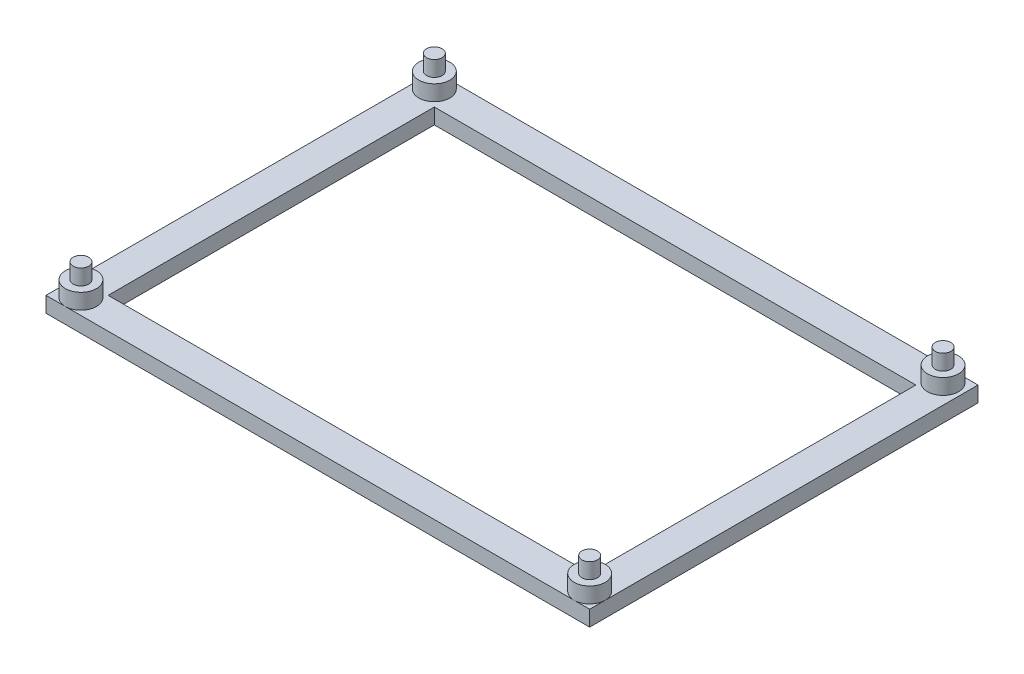
from build123d import *

# Parameters (mm, degrees)
SKETCH1_W           = 70
SKETCH1_H           = 50
BOSS_EXTRUDE1_DEPTH = 2
SKETCH2_R           = 1
BOSS_EXTRUDE2_DEPTH = 4
SKETCH3_R           = 2
BOSS_EXTRUDE3_DEPTH = 2
SKETCH4_W           = 62
SKETCH4_H           = 42
CUT_EXTRUDE1_DEPTH  = 2


with BuildPart() as part:
    # Sketch1 → Boss-Extrude1 (new body)
    with BuildSketch(Plane(origin=(0, 0, 0), x_dir=(1, 0, 0), z_dir=(0, 1, 0))):
        Rectangle(SKETCH1_W, SKETCH1_H)
    extrude(amount=BOSS_EXTRUDE1_DEPTH)

    # Sketch2 → Boss-Extrude2 (add)
    with BuildSketch(Plane(origin=(0, 2, 0), x_dir=(1, 0, 0), z_dir=(0, 1, 0))):
        with Locations(Location((-32.5, -23, 0), (0, 0, 90))):
            Circle(SKETCH2_R)
        with Locations(Location((-33, 23, 0), (0, 0, 90))):
            Circle(SKETCH2_R)
        with Locations(Location((32.5, 23, 0), (0, 0, 90))):
            Circle(SKETCH2_R)
        with Locations(Location((33, -23, 0), (0, 0, 90))):
            Circle(SKETCH2_R)
    extrude(amount=BOSS_EXTRUDE2_DEPTH)

    # Sketch3 → Boss-Extrude3 (add)
    with BuildSketch(Plane(origin=(0, 2, 0), x_dir=(1, 0, 0), z_dir=(0, 1, 0))):
        with Locations(Location((-33, 23, 0), (0, 0, 90))):
            Circle(SKETCH3_R)
        with Locations(Location((32.5, 23, 0), (0, 0, 90))):
            Circle(SKETCH3_R)
        with Locations(Location((33, -23, 0), (0, 0, 270))):
            Circle(SKETCH3_R)
        with Locations(Location((-32.5, -23, 0), (0, 0, 270))):
            Circle(SKETCH3_R)
    extrude(amount=BOSS_EXTRUDE3_DEPTH)

    # Sketch4 → Cut-Extrude1 (cut)
    with BuildSketch(Plane(origin=(0, 2, 0), x_dir=(1, 0, 0), z_dir=(0, 1, 0))):
        Rectangle(SKETCH4_W, SKETCH4_H)
    extrude(amount=-CUT_EXTRUDE1_DEPTH, mode=Mode.SUBTRACT)


solid = part.part
